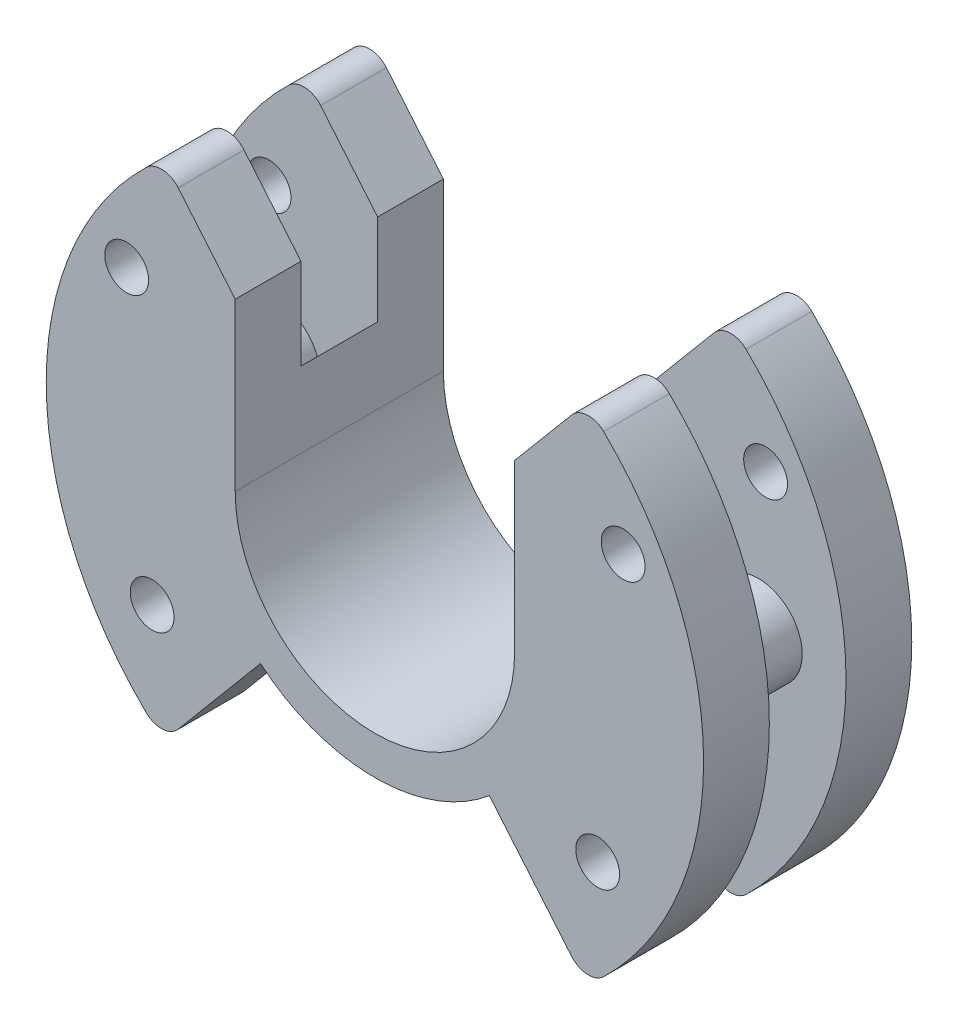
from build123d import *

# Parameters (mm, degrees)
SKETCH1_R               = 30
BOSS_EXTRUDE1_DEPTH     = 6
SKETCH2_R               = 14.5
BOSS_EXTRUDE2_DEPTH     = 13
CUT_EXTRUDE1_DEPTH      = 47.486557197
CUT_EXTRUDE1_DEPTH_BACK = 47.486557197
SKETCH3_R               = 12.75
BOSS_EXTRUDE4_START     = 13
SKETCH5_R               = 30
SKETCH5_R_2             = 12.75
BOSS_EXTRUDE4_DEPTH     = 6
CUT_EXTRUDE2_DEPTH      = 45.373415465
CUT_EXTRUDE2_DEPTH_BACK = 45.373415465
SKETCH6_R               = 2
CUT_EXTRUDE3_DEPTH      = 47.486557197
CUT_EXTRUDE3_DEPTH_BACK = 47.486557197
FILLET1_R               = 2
FILLET2_R               = 2
FILLET3_R               = 2
FILLET4_R               = 2
SKETCH8_R               = 4
BOSS_EXTRUDE5_DEPTH     = 13
FILLET5_R               = 2
FILLET6_R               = 2
FILLET7_R               = 2
FILLET8_R               = 2
CUT_EXTRUDE4_DEPTH      = 42.830642507
CUT_EXTRUDE4_DEPTH_BACK = 42.830642507
SKETCH11_W              = 25.5
SKETCH11_H              = 25


with BuildPart() as part:
    # Sketch1 → Boss-Extrude1 (new body)
    with BuildSketch(Plane.XY):
        Circle(SKETCH1_R)
    extrude(amount=-BOSS_EXTRUDE1_DEPTH)

    # Sketch2 → Boss-Extrude2 (add)
    with BuildSketch(Plane.XY):
        with Locations(Location((0, 0, 0), (0, 0, 180))):
            Circle(SKETCH2_R)
    extrude(amount=BOSS_EXTRUDE2_DEPTH)

    # Sketch3 → Cut-Extrude1 (cut, two sides: drawn at the far end of the back side and taken through both)
    with BuildSketch(Plane.XY.offset(13).offset(-CUT_EXTRUDE1_DEPTH_BACK)):
        Circle(SKETCH3_R)
    extrude(amount=CUT_EXTRUDE1_DEPTH + CUT_EXTRUDE1_DEPTH_BACK, mode=Mode.SUBTRACT)

    # Sketch5 → Boss-Extrude4 (add)
    with BuildSketch(Plane.XY.offset(BOSS_EXTRUDE4_START)):
        Circle(SKETCH5_R)
        Circle(SKETCH5_R_2, mode=Mode.SUBTRACT)
    extrude(amount=-BOSS_EXTRUDE4_DEPTH)

    # Sketch6 → Cut-Extrude2 (cut, two sides: drawn at the far end of the back side and taken through both)
    with BuildSketch(Plane.XY.offset(-CUT_EXTRUDE2_DEPTH_BACK)):
        with Locations((-20.333162568, -12.75)):
            Circle(SKETCH6_R)
        with Locations((-22.659159296, 12.75)):
            Circle(SKETCH6_R)
        with Locations((20.333162568, -12.75)):
            Circle(SKETCH6_R)
        with Locations((22.659159296, 12.75)):
            Circle(SKETCH6_R)
    extrude(amount=CUT_EXTRUDE2_DEPTH + CUT_EXTRUDE2_DEPTH_BACK, mode=Mode.SUBTRACT)

    # Sketch7 → Cut-Extrude3 (cut, two sides: drawn at the far end of the back side and taken through both)
    with BuildSketch(Plane.XY.offset(13).offset(-CUT_EXTRUDE3_DEPTH_BACK)):
        with BuildLine():
            Line((10.445298657, -12.448222201), (19.283628291, -22.981333294))
            ThreePointArc((19.283628291, -22.981333294), (0, -30), (-19.283628291, -22.981333294))
            Line((-19.283628291, -22.981333294), (-10.445298657, -12.448222201))
            ThreePointArc((-10.445298657, -12.448222201), (0, -16.25), (10.445298657, -12.448222201))
        make_face()
        with BuildLine():
            Line((-10.445298657, 12.448222201), (-19.283628291, 22.981333294))
            ThreePointArc((-19.283628291, 22.981333294), (0, 30), (19.283628291, 22.981333294))
            Line((19.283628291, 22.981333294), (10.445298657, 12.448222201))
            ThreePointArc((10.445298657, 12.448222201), (0, 16.25), (-10.445298657, 12.448222201))
        make_face()
    extrude(amount=CUT_EXTRUDE3_DEPTH + CUT_EXTRUDE3_DEPTH_BACK, mode=Mode.SUBTRACT)

    # Fillet1
    fillet1_edges = [part.edges().sort_by_distance(p)[0] for p in [
        (-19.283628291, -22.981333294, 10),
    ]]
    fillet(fillet1_edges, radius=FILLET1_R)

    # Fillet2
    fillet2_edges = [part.edges().sort_by_distance(p)[0] for p in [
        (-19.283628291, 22.981333294, 10),
    ]]
    fillet(fillet2_edges, radius=FILLET2_R)

    # Fillet3
    fillet3_edges = [part.edges().sort_by_distance(p)[0] for p in [
        (19.283628291, 22.981333294, 10),
    ]]
    fillet(fillet3_edges, radius=FILLET3_R)

    # Fillet4
    fillet4_edges = [part.edges().sort_by_distance(p)[0] for p in [
        (19.283628291, -22.981333294, 10),
    ]]
    fillet(fillet4_edges, radius=FILLET4_R)

    # Sketch8 → Boss-Extrude5 (add)
    with BuildSketch(Plane.XY.offset(13)):
        with Locations((-22, 0)):
            Circle(SKETCH8_R)
        with Locations((22, 0)):
            Circle(SKETCH8_R)
    extrude(amount=-BOSS_EXTRUDE5_DEPTH)

    # Fillet5
    fillet5_edges = [part.edges().sort_by_distance(p)[0] for p in [
        (-19.283628291, 22.981333294, -3),
    ]]
    fillet(fillet5_edges, radius=FILLET5_R)

    # Fillet6
    fillet6_edges = [part.edges().sort_by_distance(p)[0] for p in [
        (-19.283628291, -22.981333294, -3),
    ]]
    fillet(fillet6_edges, radius=FILLET6_R)

    # Fillet7
    fillet7_edges = [part.edges().sort_by_distance(p)[0] for p in [
        (19.283628291, -22.981333294, -3),
    ]]
    fillet(fillet7_edges, radius=FILLET7_R)

    # Fillet8
    fillet8_edges = [part.edges().sort_by_distance(p)[0] for p in [
        (19.283628291, 22.981333294, -3),
    ]]
    fillet(fillet8_edges, radius=FILLET8_R)

    # Sketch11 → Cut-Extrude4 (cut, two sides: drawn at the far end of the back side and taken through both)
    with BuildSketch(Plane(origin=(0, 0, -6), x_dir=(-1, 0, 0), z_dir=(0, 0, -1)).offset(-CUT_EXTRUDE4_DEPTH_BACK)):
        with Locations((0, 12.5)):
            Rectangle(SKETCH11_W, SKETCH11_H)
    extrude(amount=CUT_EXTRUDE4_DEPTH + CUT_EXTRUDE4_DEPTH_BACK, mode=Mode.SUBTRACT)


solid = part.part
